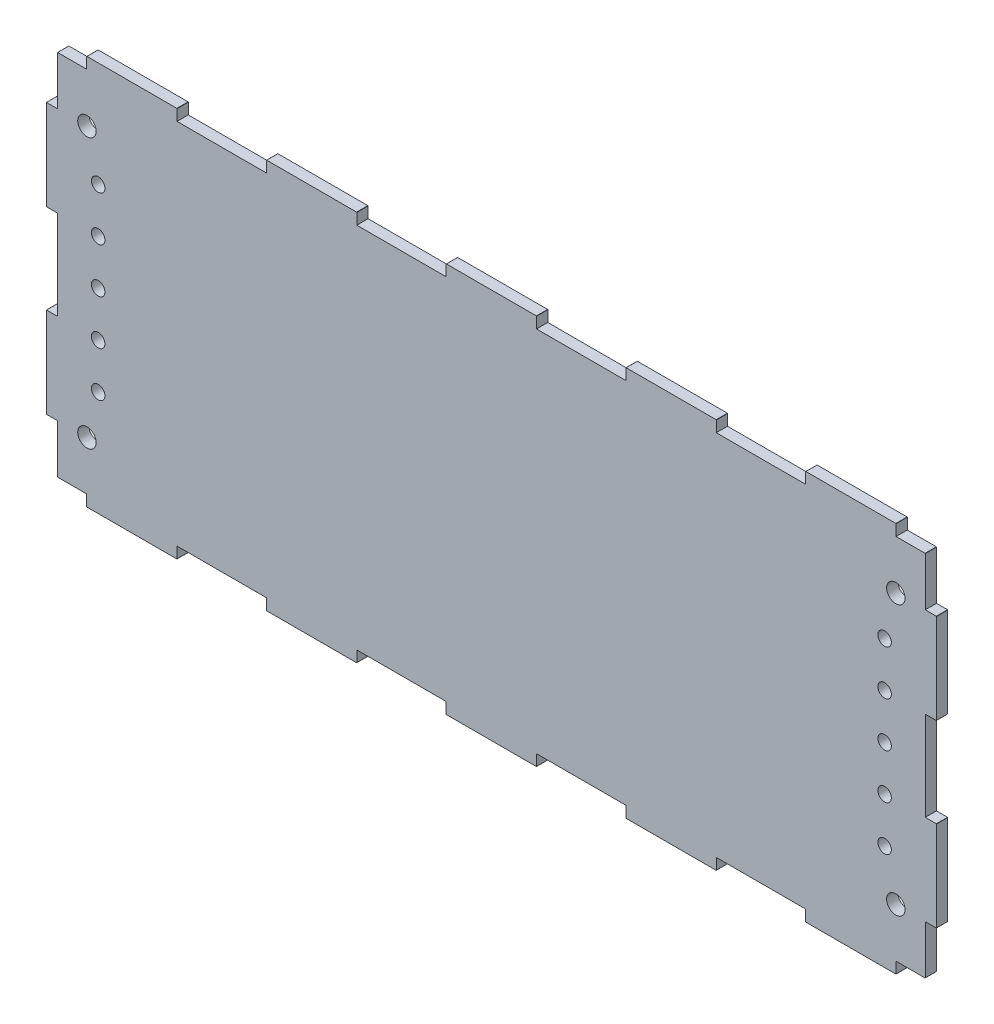
from build123d import *

# Parameters (mm, degrees)
BOSS_EXTRUDE1_DEPTH = 5
SKETCH2_R           = 3
SKETCH2_R_2         = 4.1
CUT_EXTRUDE1_DEPTH  = 217.359729386


with BuildPart() as part:
    # Model → Boss-Extrude1 (new body)
    with BuildSketch(Plane.XY):
        Polygon((-139.94, -86.83), (-139.93, -86.82), (-139.92, -86.8), (-139.91, -86.79), (-139.9, -86.77), (-139.9, -81.85), (-100.1, -81.85), (-100.1, -86.77), (-100.08, -86.81), (-100.07, -86.82), (-100.05, -86.83), (-100.04, -86.84), (-100.02, -86.85), (-59.98, -86.85), (-59.94, -86.83), (-59.93, -86.82), (-59.92, -86.8), (-59.91, -86.79), (-59.9, -86.77), (-59.9, -81.85), (-20.1, -81.85), (-20.1, -86.77), (-20.08, -86.81), (-20.07, -86.82), (-20.05, -86.83), (-20.04, -86.84), (-20.02, -86.85), (20.02, -86.85), (20.06, -86.83), (20.07, -86.82), (20.08, -86.8), (20.09, -86.79), (20.1, -86.77), (20.1, -81.85), (59.9, -81.85), (59.9, -86.77), (59.92, -86.81), (59.93, -86.82), (59.95, -86.83), (59.96, -86.84), (59.98, -86.85), (100.02, -86.85), (100.06, -86.83), (100.07, -86.82), (100.08, -86.8), (100.09, -86.79), (100.1, -86.77), (100.1, -81.85), (139.9, -81.85), (139.9, -86.77), (139.92, -86.81), (139.93, -86.82), (139.95, -86.83), (139.96, -86.84), (139.98, -86.85), (180.02, -86.85), (180.06, -86.83), (180.07, -86.82), (180.08, -86.8), (180.09, -86.79), (180.1, -86.77), (180.1, -81.85), (193.02, -81.85), (193.06, -81.83), (193.07, -81.82), (193.08, -81.8), (193.09, -81.79), (193.1, -81.77), (193.1, -60.1), (198.02, -60.1), (198.06, -60.08), (198.07, -60.07), (198.08, -60.05), (198.09, -60.04), (198.1, -60.02), (198.1, -19.98), (198.08, -19.94), (198.07, -19.93), (198.05, -19.92), (198.04, -19.91), (198.02, -19.9), (193.1, -19.9), (193.1, 19.9), (198.02, 19.9), (198.06, 19.92), (198.07, 19.93), (198.08, 19.95), (198.09, 19.96), (198.1, 19.98), (198.1, 60.02), (198.08, 60.06), (198.07, 60.07), (198.05, 60.08), (198.04, 60.09), (198.02, 60.1), (193.1, 60.1), (193.1, 81.77), (193.08, 81.81), (193.07, 81.82), (193.05, 81.83), (193.04, 81.84), (193.02, 81.85), (180.1, 81.85), (180.1, 86.77), (180.08, 86.81), (180.07, 86.82), (180.05, 86.83), (180.04, 86.84), (180.02, 86.85), (139.98, 86.85), (139.94, 86.83), (139.93, 86.82), (139.92, 86.8), (139.91, 86.79), (139.9, 86.77), (139.9, 81.85), (100.1, 81.85), (100.1, 86.77), (100.08, 86.81), (100.07, 86.82), (100.05, 86.83), (100.04, 86.84), (100.02, 86.85), (59.98, 86.85), (59.94, 86.83), (59.93, 86.82), (59.92, 86.8), (59.91, 86.79), (59.9, 86.77), (59.9, 81.85), (20.1, 81.85), (20.1, 86.77), (20.08, 86.81), (20.07, 86.82), (20.05, 86.83), (20.04, 86.84), (20.02, 86.85), (-20.02, 86.85), (-20.06, 86.83), (-20.07, 86.82), (-20.08, 86.8), (-20.09, 86.79), (-20.1, 86.77), (-20.1, 81.85), (-59.9, 81.85), (-59.9, 86.77), (-59.92, 86.81), (-59.93, 86.82), (-59.95, 86.83), (-59.96, 86.84), (-59.98, 86.85), (-100.02, 86.85), (-100.06, 86.83), (-100.07, 86.82), (-100.08, 86.8), (-100.09, 86.79), (-100.1, 86.77), (-100.1, 81.85), (-139.9, 81.85), (-139.9, 86.77), (-139.92, 86.81), (-139.93, 86.82), (-139.95, 86.83), (-139.96, 86.84), (-139.98, 86.85), (-180.02, 86.85), (-180.06, 86.83), (-180.07, 86.82), (-180.08, 86.8), (-180.09, 86.79), (-180.1, 86.77), (-180.1, 81.85), (-193.02, 81.85), (-193.06, 81.83), (-193.07, 81.82), (-193.08, 81.8), (-193.09, 81.79), (-193.1, 81.77), (-193.1, 60.1), (-198.02, 60.1), (-198.06, 60.08), (-198.07, 60.07), (-198.08, 60.05), (-198.09, 60.04), (-198.1, 60.02), (-198.1, 19.98), (-198.08, 19.94), (-198.07, 19.93), (-198.05, 19.92), (-198.04, 19.91), (-198.02, 19.9), (-193.1, 19.9), (-193.1, -19.9), (-198.02, -19.9), (-198.06, -19.92), (-198.07, -19.93), (-198.08, -19.95), (-198.09, -19.96), (-198.1, -19.98), (-198.1, -60.02), (-198.08, -60.06), (-198.07, -60.07), (-198.05, -60.08), (-198.04, -60.09), (-198.02, -60.1), (-193.1, -60.1), (-193.1, -81.77), (-193.08, -81.81), (-193.07, -81.82), (-193.05, -81.83), (-193.04, -81.84), (-193.02, -81.85), (-180.1, -81.85), (-180.1, -86.77), (-180.08, -86.81), (-180.07, -86.82), (-180.05, -86.83), (-180.04, -86.84), (-180.02, -86.85), (-139.98, -86.85), align=None)
    extrude(amount=BOSS_EXTRUDE1_DEPTH)

    # Sketch2 → Cut-Extrude1 (cut, through all)
    with BuildSketch(Plane.XY.offset(5)):
        with Locations((-175, 0)):
            Circle(SKETCH2_R)
        with Locations((175, 0)):
            Circle(SKETCH2_R)
        with Locations((-175, 20)):
            Circle(SKETCH2_R)
        with Locations((175, 20)):
            Circle(SKETCH2_R)
        with Locations((-175, 40)):
            Circle(SKETCH2_R)
        with Locations((175, 40)):
            Circle(SKETCH2_R)
        with Locations((-180, 60)):
            Circle(SKETCH2_R_2)
        with Locations((180, 60)):
            Circle(SKETCH2_R_2)
        with Locations((-175, -20)):
            Circle(SKETCH2_R)
        with Locations((175, -20)):
            Circle(SKETCH2_R)
        with Locations((-175, -40)):
            Circle(SKETCH2_R)
        with Locations((175, -40)):
            Circle(SKETCH2_R)
        with Locations((-180, -60)):
            Circle(SKETCH2_R_2)
        with Locations((180, -60)):
            Circle(SKETCH2_R_2)
    extrude(amount=-CUT_EXTRUDE1_DEPTH, mode=Mode.SUBTRACT)


solid = part.part
